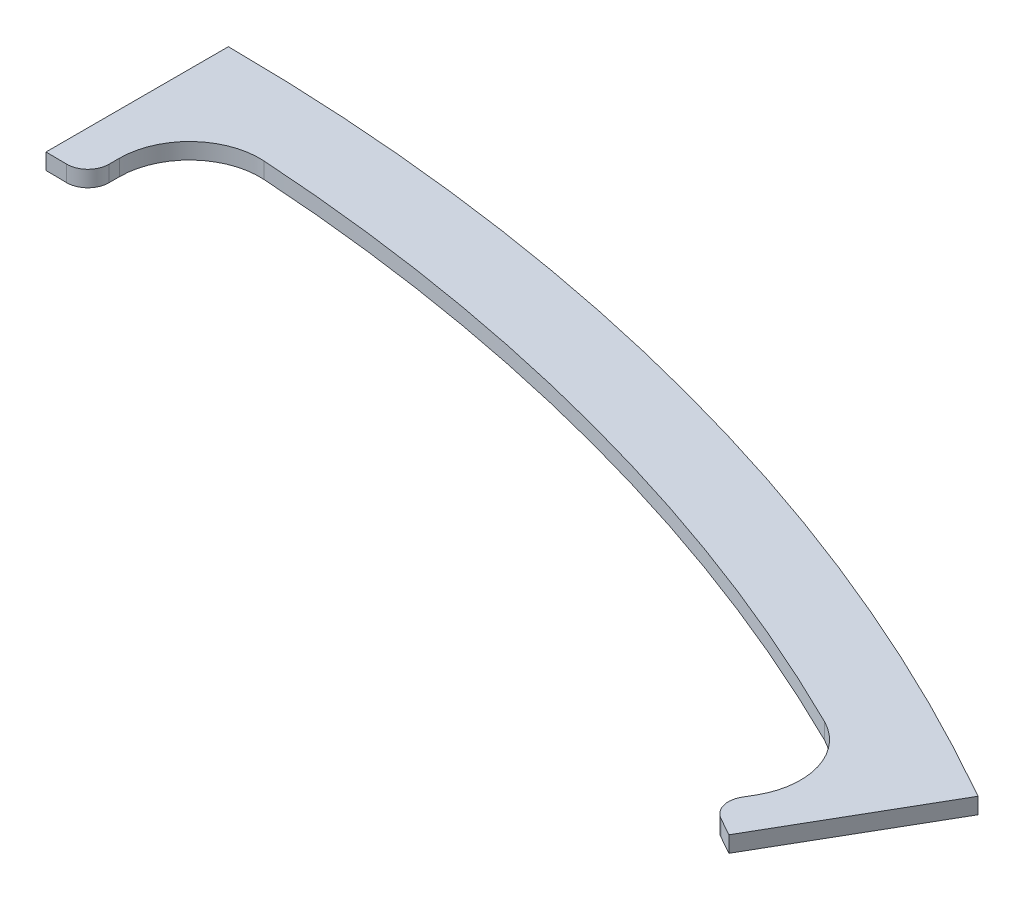
from build123d import *

# Parameters (mm, degrees)
BOSS_EXTRUDE1_DEPTH = 2.29
CUT_EXTRUDE1_DEPTH  = 3
FILLET1_R           = 10
FILLET2_R           = 3


with BuildPart() as part:
    # Sketch1 → Boss-Extrude1 (new body)
    with BuildSketch(Plane(origin=(0, 0, 0), x_dir=(1, 0, 0), z_dir=(0, 1, 0))):
        with BuildLine():
            Line((1.5, 297.496218463), (1.5, 271.496218463))
            ThreePointArc((1.5, 271.496218463), (70.269464473, 262.249211634), (134.449071126, 235.872622221))
            Line((134.449071126, 235.872622221), (147.449071126, 258.389282719))
            ThreePointArc((147.449071126, 258.389282719), (76.998665918, 287.362933321), (1.5, 297.496218463))
        make_face()
    extrude(amount=BOSS_EXTRUDE1_DEPTH)

    # Sketch3 → Cut-Extrude1 (cut)
    with BuildSketch(Plane(origin=(0, 2.29, 0), x_dir=(1, 0, 0), z_dir=(0, 1, 0))):
        with BuildLine():
            Line((7.5, 271.396751344), (129.203185143, 238.786481168))
            Line((129.203185143, 238.786481168), (136.70589842, 251.781561758))
            ThreePointArc((136.70589842, 251.781561758), (74.15175015, 276.738099028), (7.5, 286.402177897))
            Line((7.5, 286.402177897), (7.5, 271.396751344))
        make_face()
    extrude(amount=-CUT_EXTRUDE1_DEPTH, mode=Mode.SUBTRACT)

    # Fillet1
    fillet1_edges = [part.edges().sort_by_distance(p)[0] for p in [
        (7.5, 1.145, -286.402177897),
        (136.70589842, 1.145, -251.781561758),
    ]]
    fillet(fillet1_edges, radius=FILLET1_R)

    # Fillet2
    fillet2_edges = [part.edges().sort_by_distance(p)[0] for p in [
        (7.5, 1.145, -271.396751344),
        (129.203185143, 1.145, -238.786481168),
    ]]
    fillet(fillet2_edges, radius=FILLET2_R)


solid = part.part
